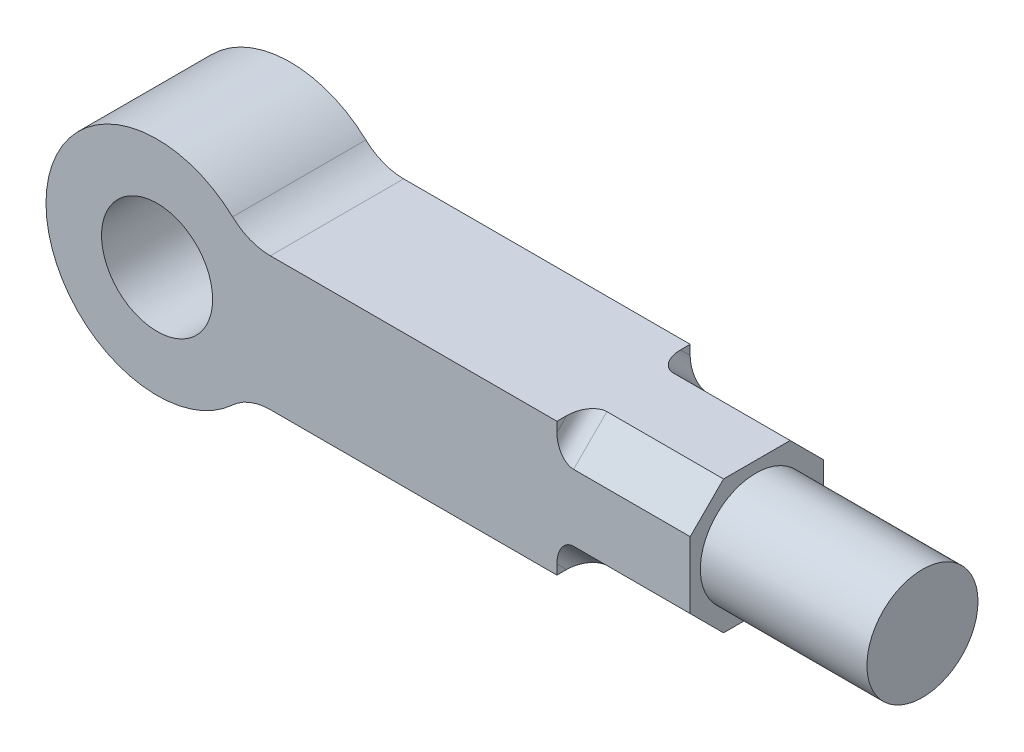
from build123d import *

# Parameters (mm, degrees)
SKETCH1_R           = 10
BOSS_EXTRUDE1_DEPTH = 24
CUT_EXTRUDE1_DEPTH  = 24
SKETCH2_3_R         = 10
BOSS_EXTRUDE4_DEPTH = 30
FILLET7_R           = 3


with BuildPart() as part:
    # Sketch1 → Boss-Extrude1 (new body)
    with BuildSketch(Plane.XY):
        with BuildLine():
            Line((20.396078054, 12), (96, 12))
            Line((96, 12), (96, -12))
            Line((96, -12), (20.396078054, -12))
            ThreePointArc((20.396078054, -12), (16.744594338, -12.690506637), (13.59738537, -14.666666667))
            ThreePointArc((13.59738537, -14.666666667), (-20, 0), (13.59738537, 14.666666667))
            ThreePointArc((13.59738537, 14.666666667), (16.744594338, 12.690506637), (20.396078054, 12))
        make_face()
        Circle(SKETCH1_R, mode=Mode.SUBTRACT)
    extrude(amount=BOSS_EXTRUDE1_DEPTH)

    # Sketch2 → Cut-Extrude1 (cut)
    with BuildSketch(Plane(origin=(96, 0, 0), x_dir=(0, 0, -1), z_dir=(1, 0, 0))):
        Polygon((-18, 12), (-24, 12), (-24, 6), align=None)
        Polygon((0, 6), (0, 12), (-6, 12), align=None)
        Polygon((-24, -6), (-24, -12), (-18, -12), align=None)
        Polygon((-5.620753108, -12), (0, -12), (0, -6), align=None)
    extrude(amount=-CUT_EXTRUDE1_DEPTH, mode=Mode.SUBTRACT)

    # Sketch2<3> → Boss-Extrude4 (add)
    with BuildSketch(Plane(origin=(96, 0, 0), x_dir=(0, 0, -1), z_dir=(1, 0, 0))):
        with Locations((-12.179136586, 0)):
            Circle(SKETCH2_3_R)
    extrude(amount=BOSS_EXTRUDE4_DEPTH)

    # Fillet7
    fillet7_edges = [part.edges().sort_by_distance(p)[0] for p in [
        (72, 9, 3),
        (72, -9, 21),
        (72, -9, 2.810376554),
        (72, 9, 21),
    ]]
    fillet(fillet7_edges, radius=FILLET7_R)


solid = part.part
